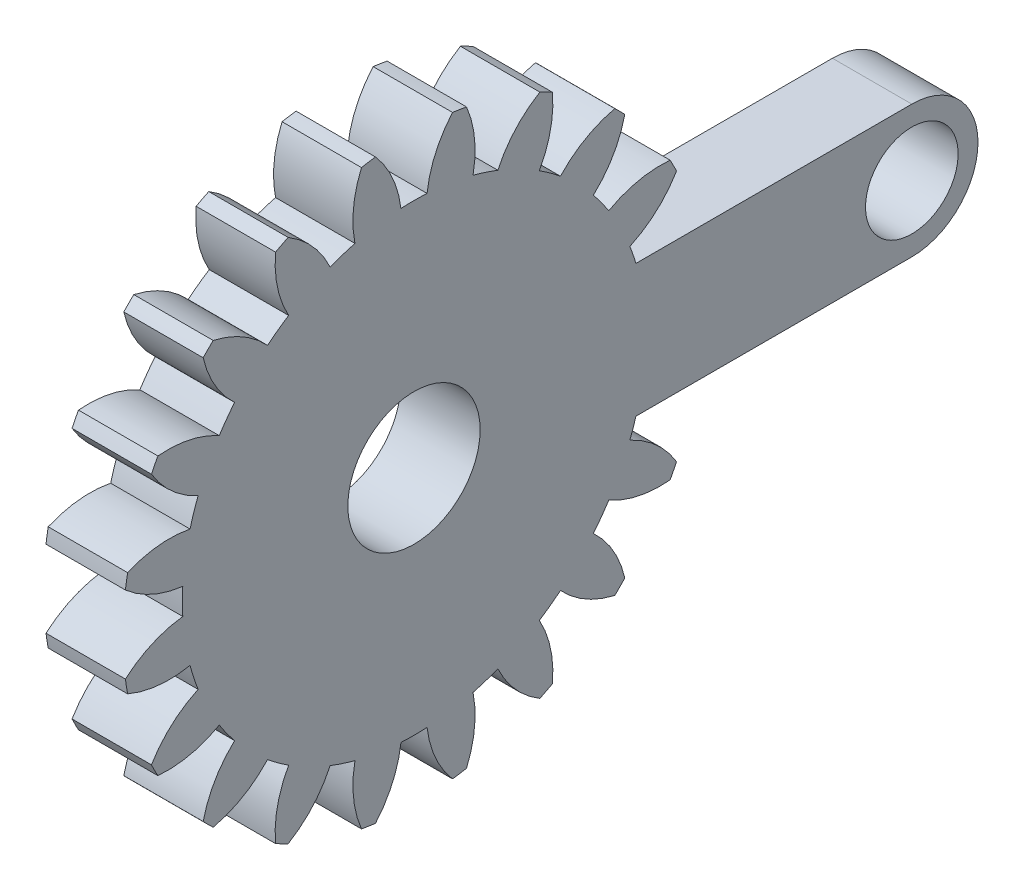
from build123d import *

# Parameters (mm, degrees)
BASPROSKE_W         = 6
BASPROSKE_H         = 22
TOOTHCUT_DEPTH      = 32.685959036
TEETHCUTS_COUNT     = 20
TEETHCUTS_ANGLE     = 342
BORSKE_R            = 2
BORE_DEPTH          = 50.0000508
SKETCH1_R           = 5
CUT_EXTRUDE1_DEPTH  = 32.417071791
BOSS_EXTRUDE1_DEPTH = 6
SKETCH3_R           = 3.5
CUT_EXTRUDE2_DEPTH  = 6


with BuildPart() as part:
    # BasProSke → Base-Revolve (revolve)
    with BuildSketch(Plane(origin=(0, 0, 0), x_dir=(1, 0, 0), z_dir=(0, 1, 0)), mode=Mode.PRIVATE) as base_revolve_sk:
        with Locations((3, 11)):
            Rectangle(BASPROSKE_W, BASPROSKE_H)
    revolve(base_revolve_sk.sketch.rotate(Axis((-10, 0, 0), (1, 0, 0)), 180), axis=Axis((-10, 0, 0), (1, 0, 0)))

    # TooCutSke → ToothCut (cut, through all)
    with BuildSketch(Plane(origin=(0, 0, 0), x_dir=(0, 0, -1), z_dir=(1, 0, 0))):
        with BuildLine():
            ThreePointArc((0.986171591, 17.471189616), (0, 17.499), (-0.986171591, 17.471189616))
            ThreePointArc((-0.986171591, 17.471189616), (-1.626916196, 19.798789858), (-2.932850173, 21.829260982))
            ThreePointArc((-2.932850173, 21.829260982), (0, 22.0254), (2.932850173, 21.829260982))
            ThreePointArc((2.932850173, 21.829260982), (1.626916196, 19.798789858), (0.986171591, 17.471189616))
        make_face()
    toothcut = extrude(amount=TOOTHCUT_DEPTH, mode=Mode.SUBTRACT)

    # TeethCuts: ToothCut ×20 about axis
    teethcuts_axis = Axis((-10, 0, 0), (1, 0, 0))
    for i in range(1, TEETHCUTS_COUNT):
        add(toothcut.rotate(teethcuts_axis, i * TEETHCUTS_ANGLE / (TEETHCUTS_COUNT - 1)), mode=Mode.SUBTRACT)

    # BorSke → Bore (cut, symmetric)
    with BuildSketch(Plane(origin=(0, 0, 0), x_dir=(0, 0, -1), z_dir=(1, 0, 0))):
        with Locations(Location((0, 0, 0), (0, 0, 180))):
            Circle(BORSKE_R)
    extrude(amount=BORE_DEPTH, both=True, mode=Mode.SUBTRACT)

    # Sketch1 → Cut-Extrude1 (cut, through all)
    with BuildSketch(Plane(origin=(6, 0, 0), x_dir=(0, 0, -1), z_dir=(1, 0, 0))):
        Circle(SKETCH1_R)
    extrude(amount=-CUT_EXTRUDE1_DEPTH, mode=Mode.SUBTRACT)

    # Sketch2 → Boss-Extrude1 (add)
    with BuildSketch(Plane.ZY):
        with BuildLine():
            Line((-37.617140139, -5), (-8.966472533, -5))
            Line((-8.966472533, -5), (-8.966472533, 5))
            Line((-8.966472533, 5), (-37.617140139, 5))
            ThreePointArc((-37.617140139, 5), (-34.081606234, 3.535533906), (-32.617140139, 0))
            ThreePointArc((-32.617140139, 0), (-34.081606234, -3.535533906), (-37.617140139, -5))
        make_face()
        with BuildLine():
            ThreePointArc((-37.617140139, 5), (-42.617140139, 0), (-37.617140139, -5))
            Line((-37.617140139, -5), (-37.617140139, 5))
        make_face()
        with BuildLine():
            Line((-37.617140139, 5), (-37.617140139, -5))
            ThreePointArc((-37.617140139, -5), (-34.081606234, -3.535533906), (-32.617140139, 0))
            ThreePointArc((-32.617140139, 0), (-34.081606234, 3.535533906), (-37.617140139, 5))
        make_face()
    extrude(amount=-BOSS_EXTRUDE1_DEPTH)

    # Sketch3 → Cut-Extrude2 (cut)
    with BuildSketch(Plane.ZY):
        with Locations((-37.617140139, 0)):
            Circle(SKETCH3_R)
    extrude(amount=-CUT_EXTRUDE2_DEPTH, mode=Mode.SUBTRACT)


solid = part.part
